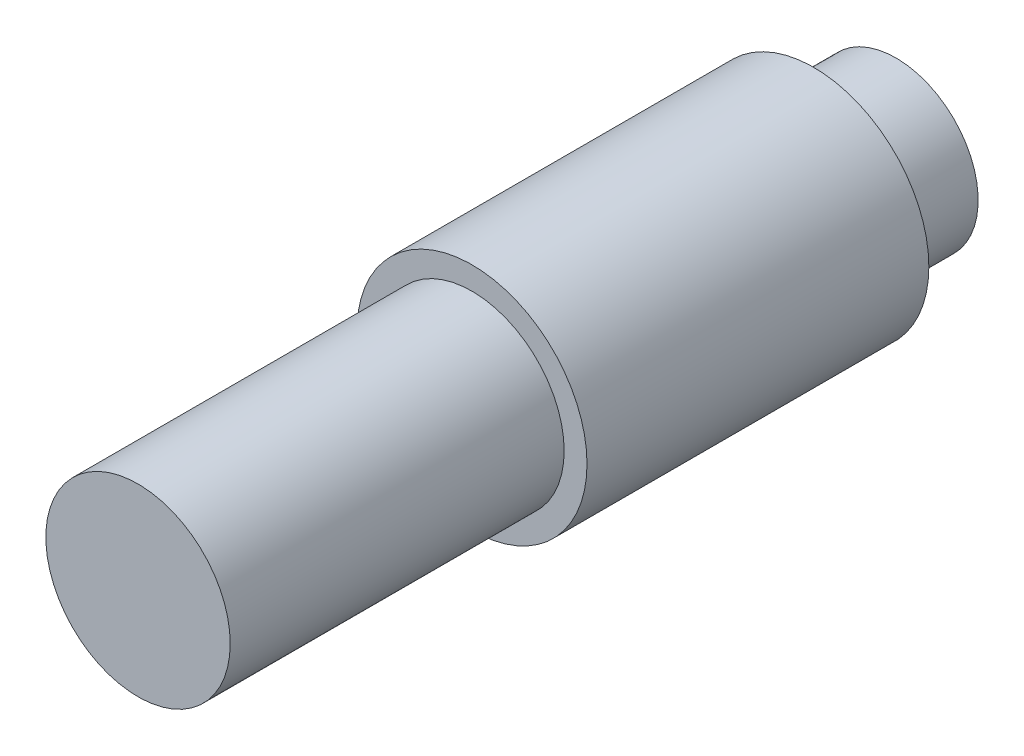
from build123d import *

# Parameters (mm, degrees)
SKETCH1_R           = 17.5
BOSS_EXTRUDE1_DEPTH = 52
SKETCH2_R           = 14.025
BOSS_EXTRUDE2_DEPTH = 50.8
SKETCH4_R           = 12.5
BOSS_EXTRUDE3_DEPTH = 12.5


with BuildPart() as part:
    # Sketch1 → Boss-Extrude1 (new body)
    with BuildSketch(Plane.XY):
        Circle(SKETCH1_R)
    extrude(amount=BOSS_EXTRUDE1_DEPTH)

    # Sketch2 → Boss-Extrude2 (add)
    with BuildSketch(Plane.XY.offset(52)):
        Circle(SKETCH2_R)
    extrude(amount=BOSS_EXTRUDE2_DEPTH)

    # Sketch4 → Boss-Extrude3 (add)
    with BuildSketch(Plane(origin=(0, 0, 0), x_dir=(-1, 0, 0), z_dir=(0, 0, -1))):
        Circle(SKETCH4_R)
    extrude(amount=BOSS_EXTRUDE3_DEPTH)


solid = part.part
